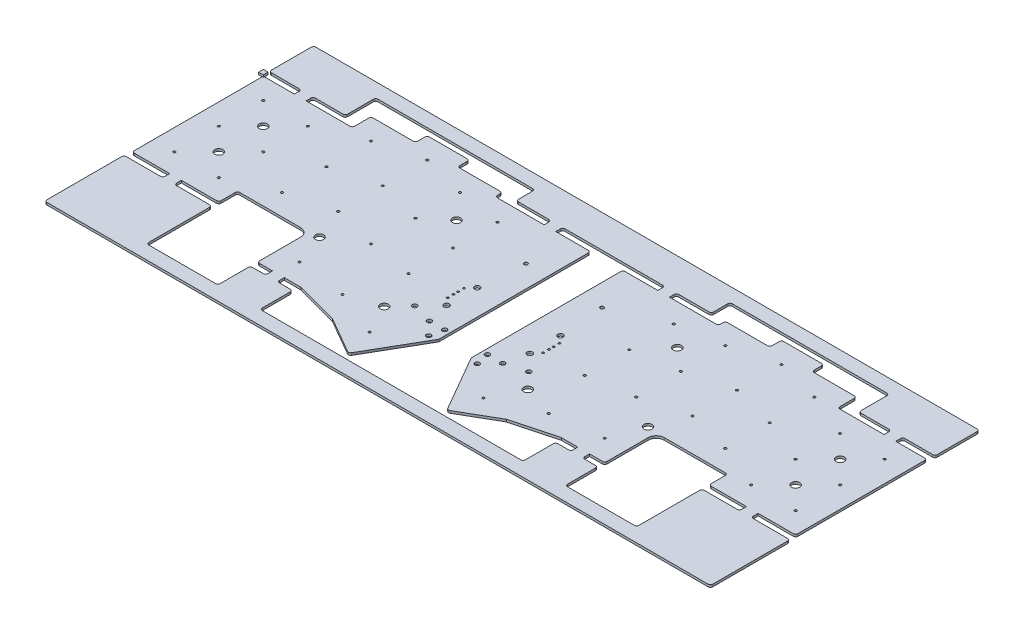
from build123d import *

# Parameters (mm, degrees)
SKETCH1_R           = 1.75
SKETCH1_R_2         = 0.5
SKETCH1_R_3         = 0.75
SKETCH1_R_4         = 1.15
SKETCH1_R_5         = 0.45
SKETCH1_R_6         = 1
BOSS_EXTRUDE1_DEPTH = 1
BOSS_EXTRUDE2_START = -1
SKETCH2_W           = 2
SKETCH2_H           = 2
BOSS_EXTRUDE2_DEPTH = 1
FILLET1_R           = 1


with BuildPart() as part:
    # Sketch1 → Boss-Extrude1 (new body)
    with BuildSketch(Plane(origin=(0, 0, 0), x_dir=(1, 0, 0), z_dir=(0, 1, 0))):
        with BuildLine():
            Line((135.58, 3.5), (135.58, -60.171181315))
            ThreePointArc((135.58, -60.171181315), (135.545925826, -60.43000036), (135.446025404, -60.671181315))
            Line((135.446025404, -60.671181315), (130.690658231, -68.907718867))
            Line((130.690658231, -68.907718867), (121.915658231, -84.106464704))
            ThreePointArc((121.915658231, -84.106464704), (121.308451872, -84.57239053), (120.549632827, -84.472490107))
            Line((120.549632827, -84.472490107), (105.293879787, -75.664576983))
            Line((105.293879787, -75.664576983), (86.765826249, -70.7))
            Line((86.765826249, -70.7), (69.15, -70.7))
            ThreePointArc((69.15, -70.7), (68.442893219, -70.407106781), (68.15, -69.7))
            Line((68.15, -69.7), (68.15, -52.15))
            ThreePointArc((68.15, -52.15), (67.124873734, -49.675126266), (64.65, -48.65))
            Line((64.65, -48.65), (57.15, -48.65))
            Line((57.15, -48.65), (38.6, -48.65))
            ThreePointArc((38.6, -48.65), (37.892893219, -48.942893219), (37.6, -49.65))
            Line((37.6, -49.65), (37.6, -55.65))
            ThreePointArc((37.6, -55.65), (37.307106781, -56.357106781), (36.6, -56.65))
            Line((36.6, -56.65), (19.05, -56.65))
            Line((19.05, -56.65), (1.5, -56.65))
            ThreePointArc((1.5, -56.65), (0.792893219, -56.357106781), (0.5, -55.65))
            Line((0.5, -55.65), (0.5, -38.1))
            Line((0.5, -38.1), (0.5, -19.05))
            Line((0.5, -19.05), (0.5, -1.5))
            ThreePointArc((0.5, -1.5), (0.792893219, -0.792893219), (1.5, -0.5))
            Line((1.5, -0.5), (19.05, -0.5))
            Line((19.05, -0.5), (37.6, -0.5))
            ThreePointArc((37.6, -0.5), (38.307106781, -0.207106781), (38.6, 0.5))
            Line((38.6, 0.5), (38.6, 6.5))
            ThreePointArc((38.6, 6.5), (38.892893219, 7.207106781), (39.6, 7.5))
            Line((39.6, 7.5), (56.65, 7.5))
            ThreePointArc((56.65, 7.5), (57.357106781, 7.792893219), (57.65, 8.5))
            Line((57.65, 8.5), (57.65, 11.5))
            ThreePointArc((57.65, 11.5), (57.942893219, 12.207106781), (58.65, 12.5))
            Line((58.65, 12.5), (74.7, 12.5))
            ThreePointArc((74.7, 12.5), (75.407106781, 12.207106781), (75.7, 11.5))
            Line((75.7, 11.5), (75.7, 8.5))
            ThreePointArc((75.7, 8.5), (75.992893219, 7.792893219), (76.7, 7.5))
            Line((76.7, 7.5), (93.75, 7.5))
            ThreePointArc((93.75, 7.5), (94.457106781, 7.207106781), (94.75, 6.5))
            Line((94.75, 6.5), (94.75, 5.5))
            ThreePointArc((94.75, 5.5), (95.042893219, 4.792893219), (95.75, 4.5))
            Line((95.75, 4.5), (114.3, 4.5))
            Line((114.3, 4.5), (134.58, 4.5))
            ThreePointArc((134.58, 4.5), (135.287106781, 4.207106781), (135.58, 3.5))
        make_face()
        with Locations(Location((19.05, -19.05, 0), (0, 0, 270))):
            Circle(SKETCH1_R, mode=Mode.SUBTRACT)
        with Locations(Location((19.05, -38.1, 0), (0, 0, 270))):
            Circle(SKETCH1_R, mode=Mode.SUBTRACT)
        with Locations(Location((72.2, -48.15, 0), (0, 0, 270))):
            Circle(SKETCH1_R, mode=Mode.SUBTRACT)
        with Locations(Location((111.778437743, -60.00946922, 0), (0, 0, 270))):
            Circle(SKETCH1_R, mode=Mode.SUBTRACT)
        with Locations(Location((95.25, -12.55, 0), (0, 0, 270))):
            Circle(SKETCH1_R, mode=Mode.SUBTRACT)
        with Locations(Location((9.525, -9.525, 0), (0, 0, 270))):
            Circle(SKETCH1_R_2, mode=Mode.SUBTRACT)
        with Locations(Location((28.575, -9.525, 0), (0, 0, 270))):
            Circle(SKETCH1_R_2, mode=Mode.SUBTRACT)
        with Locations(Location((9.525, -28.575, 0), (0, 0, 270))):
            Circle(SKETCH1_R_2, mode=Mode.SUBTRACT)
        with Locations(Location((28.575, -28.575, 0), (0, 0, 270))):
            Circle(SKETCH1_R_2, mode=Mode.SUBTRACT)
        with Locations(Location((9.525, -47.625, 0), (0, 0, 270))):
            Circle(SKETCH1_R_2, mode=Mode.SUBTRACT)
        with Locations(Location((28.575, -47.625, 0), (0, 0, 270))):
            Circle(SKETCH1_R_2, mode=Mode.SUBTRACT)
        with Locations(Location((47.625, -39.625, 0), (0, 0, 270))):
            Circle(SKETCH1_R_2, mode=Mode.SUBTRACT)
        with Locations(Location((47.625, -20.575, 0), (0, 0, 270))):
            Circle(SKETCH1_R_2, mode=Mode.SUBTRACT)
        with Locations(Location((47.625, -1.525, 0), (0, 0, 270))):
            Circle(SKETCH1_R_2, mode=Mode.SUBTRACT)
        with Locations(Location((66.675, 3.475, 0), (0, 0, 270))):
            Circle(SKETCH1_R_2, mode=Mode.SUBTRACT)
        with Locations(Location((66.675, -15.575, 0), (0, 0, 270))):
            Circle(SKETCH1_R_2, mode=Mode.SUBTRACT)
        with Locations(Location((66.675, -34.625, 0), (0, 0, 270))):
            Circle(SKETCH1_R_2, mode=Mode.SUBTRACT)
        with Locations(Location((85.725, -39.625, 0), (0, 0, 270))):
            Circle(SKETCH1_R_2, mode=Mode.SUBTRACT)
        with Locations(Location((85.725, -20.575, 0), (0, 0, 270))):
            Circle(SKETCH1_R_2, mode=Mode.SUBTRACT)
        with Locations(Location((85.725, -1.525, 0), (0, 0, 270))):
            Circle(SKETCH1_R_2, mode=Mode.SUBTRACT)
        with Locations(Location((104.775, -4.525, 0), (0, 0, 270))):
            Circle(SKETCH1_R_2, mode=Mode.SUBTRACT)
        with Locations(Location((104.775, -23.575, 0), (0, 0, 270))):
            Circle(SKETCH1_R_2, mode=Mode.SUBTRACT)
        with Locations(Location((104.775, -42.625, 0), (0, 0, 270))):
            Circle(SKETCH1_R_2, mode=Mode.SUBTRACT)
        with Locations(Location((77.175, -61.675, 0), (0, 0, 270))):
            Circle(SKETCH1_R_2, mode=Mode.SUBTRACT)
        with Locations(Location((98.3656949, -64.464807909, 0), (0, 0, 270))):
            Circle(SKETCH1_R_2, mode=Mode.SUBTRACT)
        with Locations(Location((118.112278962, -72.644110838, 0), (0, 0, 270))):
            Circle(SKETCH1_R_2, mode=Mode.SUBTRACT)
        with Locations(Location((126.19, -13.78, 0), (0, 0, 270))):
            Circle(SKETCH1_R_3, mode=Mode.SUBTRACT)
        with Locations(Location((124.68, -33.105, 0), (0, 0, 270))):
            Circle(SKETCH1_R_4, mode=Mode.SUBTRACT)
        with Locations(Location((124.68, -46.245, 0), (0, 0, 270))):
            Circle(SKETCH1_R_4, mode=Mode.SUBTRACT)
        with Locations(Location((122.08, -38.675, 0), (0, 0, 270))):
            Circle(SKETCH1_R_5, mode=Mode.SUBTRACT)
        with Locations(Location((122.08, -36.175, 0), (0, 0, 270))):
            Circle(SKETCH1_R_5, mode=Mode.SUBTRACT)
        with Locations(Location((122.08, -43.175, 0), (0, 0, 90))):
            Circle(SKETCH1_R_5, mode=Mode.SUBTRACT)
        with Locations(Location((122.08, -40.675, 0), (0, 0, 90))):
            Circle(SKETCH1_R_5, mode=Mode.SUBTRACT)
        with Locations(Location((133.33, -55.75, 0), (0, 0, 270))):
            Circle(SKETCH1_R_6, mode=Mode.SUBTRACT)
        with Locations(Location((126.83, -55.75, 0), (0, 0, 270))):
            Circle(SKETCH1_R_6, mode=Mode.SUBTRACT)
        with Locations(Location((118.08, -53.25, 0), (0, 0, 270))):
            Circle(SKETCH1_R_6, mode=Mode.SUBTRACT)
        with Locations(Location((132.08, -61.332903769, 0), (0, 0, 270))):
            Circle(SKETCH1_R_6, mode=Mode.SUBTRACT)
    extrude(amount=BOSS_EXTRUDE1_DEPTH)

    # Sketch2 → Boss-Extrude2 (add)
    with BuildSketch(Plane(origin=(0, 1, 0), x_dir=(1, 0, 0), z_dir=(0, 1, 0)).offset(BOSS_EXTRUDE2_START)):
        Polygon((142.5, 15.5), (142.5, 21.5), (0, 21.5), (0, 15.5), (0, 2.5), (13.8, 2.5), (13.8, -3.5), (18.8, -3.5), (18.8, 2.5), (32.6, 2.5), (32.6, 15.5), (100.75, 15.5), (100.75, 7.5), (115.665, 7.5), (115.665, 1.5), (120.665, 1.5), (120.665, 7.5), (142.5, 7.5), align=None)
        Polygon((37.6, -59.65), (37.6, -87.606464704), (68.15, -87.606464704), (68.15, -73.7), (74.675, -73.7), (74.675, -67.7), (79.675, -67.7), (79.675, -73.7), (86.2, -73.7), (86.2, -87.606464704), (131.120436632, -87.606464704), (142.5, -87.606464704), (142.5, -93.606464704), (0, -93.606464704), (0, -59.65), (16.55, -59.65), (16.55, -53.65), (21.55, -53.65), (21.55, -59.65), align=None)
        with Locations((-1, 1)):
            Rectangle(SKETCH2_W, SKETCH2_H)
    extrude(amount=BOSS_EXTRUDE2_DEPTH)


with BuildPart() as boss_extrude2_piece_1:
    # of the separate pieces the step leaves, piece 1, a body of its own (boss_extrude2_pieces)
    add(part.part.solids().sort_by_distance((93.75, 0, -7.5))[0])

    # Fillet1
    fillet1_edges = [boss_extrude2_piece_1.edges().sort_by_distance(p)[0] for p in [
        (115.665, 0.5, -7.5),
        (13.8, 0.5, -2.5),
        (120.665, 0.5, -7.5),
        (0, 0.5, -21.5),
        (0, 0.5, -2.5),
        (18.8, 0.5, -2.5),
        (32.6, 0.5, -2.5),
        (32.6, 0.5, -15.5),
        (100.75, 0.5, -15.5),
        (100.75, 0.5, -7.5),
        (21.55, 0.5, 59.65),
        (79.675, 0.5, 73.7),
        (16.55, 0.5, 59.65),
        (0, 0.5, 59.65),
        (0, 0.5, 93.606464704),
        (86.2, 0.5, 87.606464704),
        (86.2, 0.5, 73.7),
        (74.675, 0.5, 73.7),
        (68.15, 0.5, 73.7),
        (68.15, 0.5, 87.606464704),
        (37.6, 0.5, 87.606464704),
        (37.6, 0.5, 59.65),
    ]]
    fillet(fillet1_edges, radius=FILLET1_R)

    # Mirror1: Boss-Extrude2 piece 1 across plane


with BuildPart() as boss_extrude2_piece_2:
    # of the separate pieces the step leaves, piece 2, a body of its own (boss_extrude2_pieces)
    add(part.part.solids().sort_by_distance((0, 0, 0))[0])


with BuildPart() as boss_extrude2_piece_1_1:
    add(boss_extrude2_piece_1.part)
    add(boss_extrude2_piece_1.part.mirror(Plane(origin=(142.5, 1, -3.5), x_dir=(0, 0, 1), z_dir=(1, 0, 0))))


solid = Compound([boss_extrude2_piece_2.part, boss_extrude2_piece_1_1.part])
